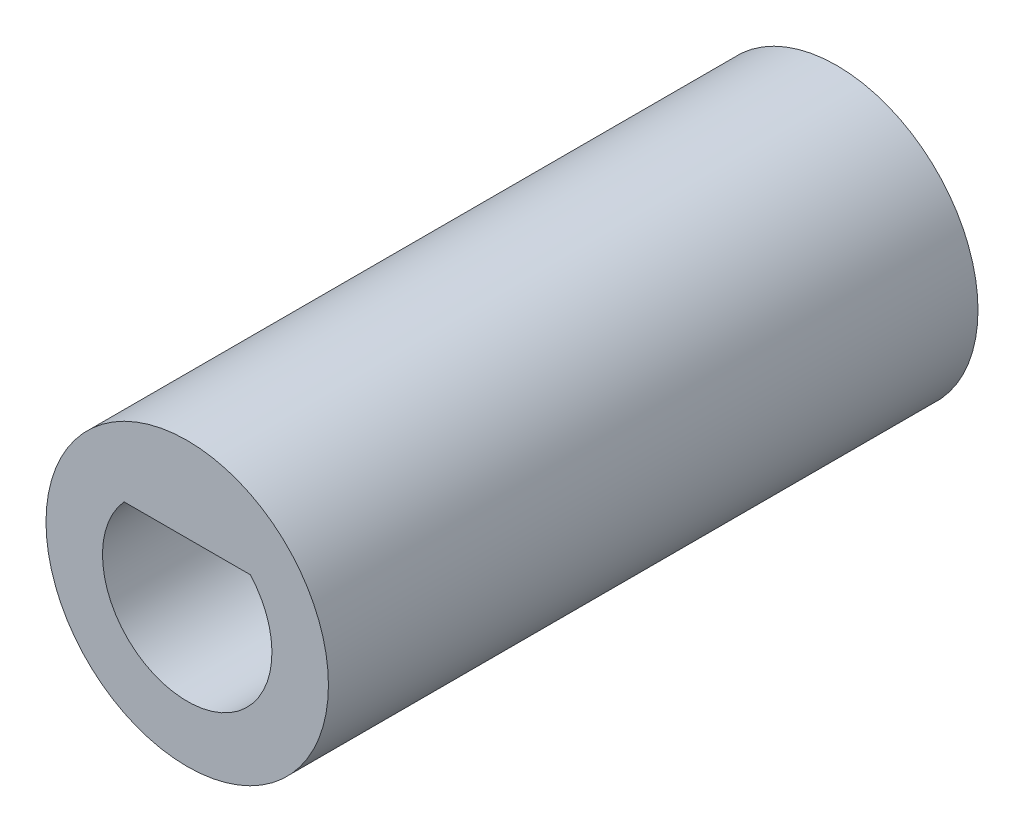
from build123d import *

# Parameters (mm, degrees)
SKETCH_1_R          = 5
EXTRUDE_1_DEPTH     = 23
CUT_EXTRUDE_1_DEPTH = 10
SKETCH_3_R          = 4
CUT_EXTRUDE_2_DEPTH = 13


with BuildPart() as part:
    # 草图1 → 凸台-拉伸1 (new body)
    with BuildSketch(Plane.XY):
        Circle(SKETCH_1_R)
    extrude(amount=EXTRUDE_1_DEPTH)

    # 草图2 → 切除-拉伸1 (cut)
    with BuildSketch(Plane.XY.offset(23)):
        with BuildLine():
            Line((-2.236067977, 2), (2.236067977, 2))
            ThreePointArc((2.236067977, 2), (0, -3), (-2.236067977, 2))
        make_face()
    extrude(amount=-CUT_EXTRUDE_1_DEPTH, mode=Mode.SUBTRACT)

    # 草图3 → 切除-拉伸2 (cut)
    with BuildSketch(Plane(origin=(0, 0, 0), x_dir=(-1, 0, 0), z_dir=(0, 0, -1))):
        Circle(SKETCH_3_R)
    extrude(amount=-CUT_EXTRUDE_2_DEPTH, mode=Mode.SUBTRACT)


solid = part.part
